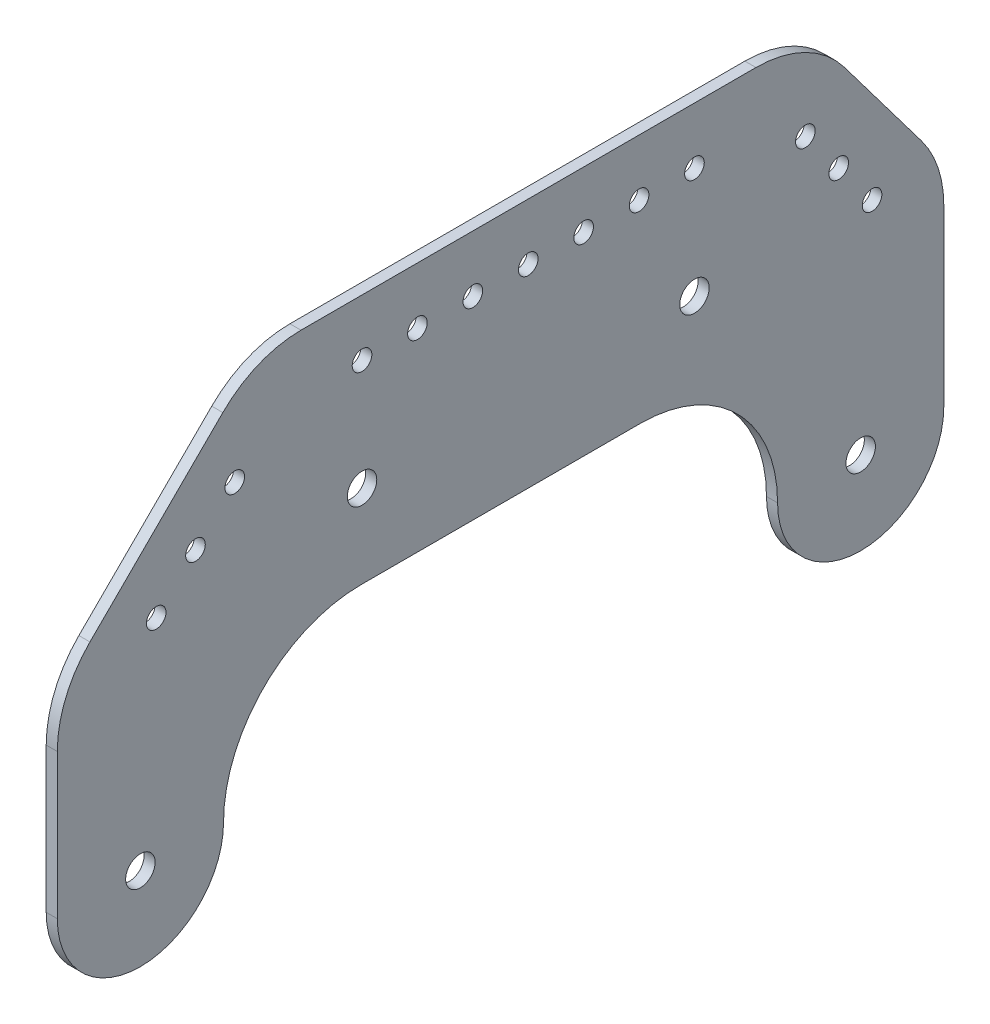
from build123d import *

# Parameters (mm, degrees)
BOSS_EXTRUDE1_DEPTH     = 2.54
F_1_4_CLEARANCE_HOLE1_D = 6.7564
F_8_CLEARANCE_HOLE2_D   = 4.4958


with BuildPart() as part:
    # Sketch1 → Boss-Extrude1 (new body)
    with BuildSketch(Plane(origin=(0, 0, 0), x_dir=(0, 0, -1), z_dir=(1, 0, 0))):
        with BuildLine():
            Line((50.546, 31.496), (114.554, 31.496))
            ThreePointArc((114.554, 31.496), (136.82503518, 22.27103518), (146.05, 0))
            ThreePointArc((146.05, 0), (165.1, -19.05), (184.15, 0))
            Line((184.15, 0), (184.15, 40.072825067))
            ThreePointArc((184.15, 40.072825067), (182.836868766, 48.134013135), (179.03324779, 55.36170531))
            Line((179.03324779, 55.36170531), (161.374573217, 78.788880244))
            ThreePointArc((161.374573217, 78.788880244), (152.423192921, 86.232108989), (141.091325427, 88.9))
            Line((141.091325427, 88.9), (36.810551917, 88.9))
            ThreePointArc((36.810551917, 88.9), (27.119806989, 86.978702323), (18.895109756, 81.505469508))
            Line((18.895109756, 81.505469508), (-11.56544216, 51.197220351))
            ThreePointArc((-11.56544216, 51.197220351), (-17.104341079, 42.941309016), (-19.05, 33.191750843))
            Line((-19.05, 33.191750843), (-19.05, 0))
            ThreePointArc((-19.05, 0), (0, -19.05), (19.05, 0))
            ThreePointArc((19.05, 0), (28.27496482, 22.27103518), (50.546, 31.496))
        make_face()
    extrude(amount=BOSS_EXTRUDE1_DEPTH)

    # 1/4 Clearance Hole1 (through all)
    with Locations(Plane(origin=(2.54, 0, 0), x_dir=(0, 0, -1), z_dir=(1, 0, 0))):
        with Locations((50.8, 50.546), (127, 50.546), (165.1, 0), (0, 0)):
            Hole(F_1_4_CLEARANCE_HOLE1_D / 2)

    # #8 Clearance Hole2 (through all)
    with Locations(Plane(origin=(2.54, 0, 0), x_dir=(0, 0, -1), z_dir=(1, 0, 0))):
        with Locations((76.2, 75.946), (88.9, 75.946), (101.6, 75.946), (21.625289632, 66.306331256), (12.622554878, 57.348610175), (3.619820124, 48.390889095), (152.417846487, 69.57247655), (160.062286608, 59.430852655), (167.70672673, 49.28922876), (63.5, 75.946), (50.8, 75.946), (114.3, 75.946), (127, 75.946)):
            Hole(F_8_CLEARANCE_HOLE2_D / 2)


solid = part.part
